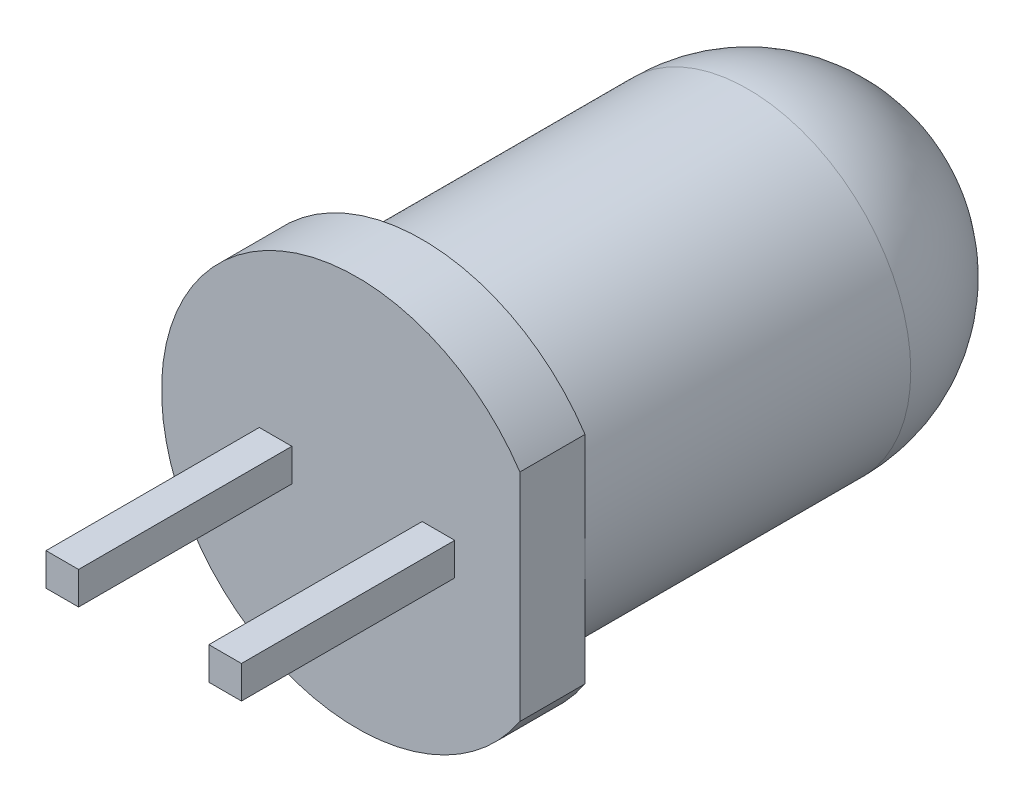
from build123d import *

# Parameters (mm, degrees)
SKETCH5_W               = 0.5
SKETCH5_H               = 29
SKETCH5_H_2             = 27
BOSS_EXTRUDE1_DEPTH     = 0.25
SKETCH6_W               = 3.089069264
SKETCH6_H               = 11.690007215
CUT_EXTRUDE1_DEPTH      = 2.5
CUT_EXTRUDE2_DEPTH      = 30.534698967
CUT_EXTRUDE2_DEPTH_BACK = 30.534698967
SKETCH7_W               = 17.118012924
SKETCH7_H               = 27.873578567


with BuildPart() as part:
    # Sketch4 → Revolve1 (revolve)
    with BuildSketch(Plane(origin=(0, 0, 0), x_dir=(1, 0, 0), z_dir=(0, 1, 0))):
        with BuildLine():
            Line((-2.5, 4.771615798), (-2.5, -0.228384202))
            Line((-2.5, -0.228384202), (-3, -0.228384202))
            Line((-3, -0.228384202), (-3, -1.228384202))
            Line((-3, -1.228384202), (0, -1.228384202))
            Line((0, -1.228384202), (0, 7.271615798))
            ThreePointArc((0, 7.271615798), (-1.767766953, 6.539382751), (-2.5, 4.771615798))
        make_face()
    revolve(axis=Axis((0, 0, -8.02238806), (0, 0, 1)))

    # Sketch5 → Boss-Extrude1 (add, symmetric)
    with BuildSketch(Plane(origin=(0, 0, 0), x_dir=(1, 0, 0), z_dir=(0, 1, 0))):
        with Locations((-1.25, -14.728384202)):
            Rectangle(SKETCH5_W, SKETCH5_H)
        with Locations((1.25, -13.728384202)):
            Rectangle(SKETCH5_W, SKETCH5_H_2)
    extrude(amount=BOSS_EXTRUDE1_DEPTH, both=True)

    # Sketch6 → Cut-Extrude1 (cut, symmetric)
    with BuildSketch(Plane(origin=(0, 0, 0), x_dir=(1, 0, 0), z_dir=(0, 1, 0))):
        with Locations((4.044534632, -0.802626626)):
            Rectangle(SKETCH6_W, SKETCH6_H)
    extrude(amount=CUT_EXTRUDE1_DEPTH, both=True, mode=Mode.SUBTRACT)

    # Sketch7 → Cut-Extrude2 (cut, two sides: drawn at the far end of the back side and taken through both)
    with BuildSketch(Plane(origin=(0, 0, 0), x_dir=(1, 0, 0), z_dir=(0, 1, 0)).offset(-CUT_EXTRUDE2_DEPTH_BACK)):
        with Locations((0.81040788, -18.439111074)):
            Rectangle(SKETCH7_W, SKETCH7_H)
    extrude(amount=CUT_EXTRUDE2_DEPTH + CUT_EXTRUDE2_DEPTH_BACK, mode=Mode.SUBTRACT)


solid = part.part
